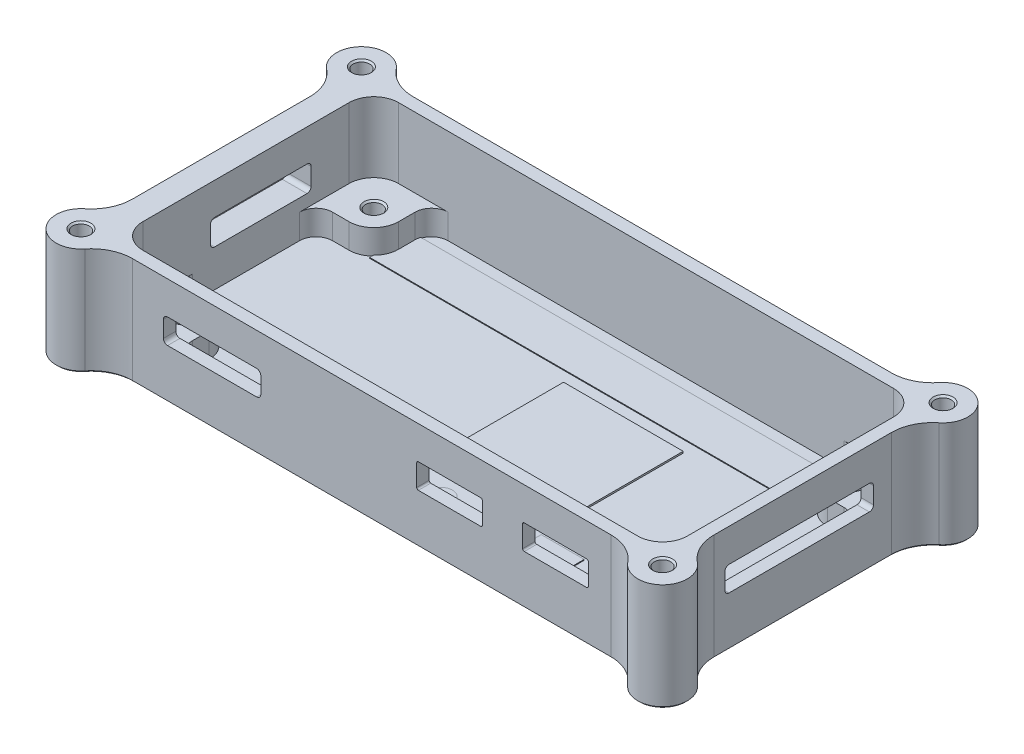
from build123d import *

# Parameters (mm, degrees)
EXTRUDE_2_DEPTH           = 1.5
EXTRUDE_3_DEPTH           = 11.5
EXTRUDE_6_DEPTH           = 3
FILLET_3_R                = 2
HOLE_WIZARD_2_0_2_1_D     = 2
HOLE_WIZARD_2_0_2_1_DEPTH = 4
HOLE_WIZARD_2_0_2_1_TIP   = 0.600860619
SKETCH_13_W               = 12.2
SKETCH_13_H               = 3.1
CUT_EXTRUDE_2_DEPTH       = 3
FILLET_4_R                = 0.5
CUT_EXTRUDE_3_DEPTH       = 2
CUT_EXTRUDE_4_DEPTH       = 3
CUT_EXTRUDE_5_DEPTH       = 2
CHAMFER_1_SIZE            = 0.2
SKETCH_17_W               = 80
SKETCH_17_H               = 40
CUT_EXTRUDE_6_DEPTH       = 15
SKETCH_20_R               = 3
SKETCH_20_R_2             = 1
EXTRUDE_11_DEPTH          = 13
FILLET_7_R                = 5
SKETCH_21_W               = 14.5
SKETCH_21_H               = 14.5
EXTRUDE_12_DEPTH          = 0.2
EXTRUDE_13_DEPTH          = 0.1
SKETCH_23_W               = 5.2
SKETCH_23_H               = 5.2
EXTRUDE_14_DEPTH          = 0.1
SKETCH_24_R               = 1.4
EXTRUDE_15_DEPTH          = 0.1
CHAMFER_2_SIZE            = 0.2
CHAMFER_3_SIZE            = 0.2
SKETCH_25_W               = 8
SKETCH_25_H               = 2.6
EXTRUDE_16_DEPTH          = 0.1


with BuildPart() as part:
    # 草图3 → 凸台-拉伸2 (new body)
    with BuildSketch(Plane(origin=(0, 0, 0), x_dir=(1, 0, 0), z_dir=(0, 1, 0))):
        with BuildLine():
            Line((33, -17.5), (-33, -17.5))
            ThreePointArc((-33, -17.5), (-35.121320344, -16.621320344), (-36, -14.5))
            Line((-36, -14.5), (-36, 14.5))
            ThreePointArc((-36, 14.5), (-35.121320344, 16.621320344), (-33, 17.5))
            Line((-33, 17.5), (33, 17.5))
            ThreePointArc((33, 17.5), (35.121320344, 16.621320344), (36, 14.5))
            Line((36, 14.5), (36, -14.5))
            ThreePointArc((36, -14.5), (35.121320344, -16.621320344), (33, -17.5))
        make_face()
    extrude(amount=EXTRUDE_2_DEPTH)

    # 草图5 → 凸台-拉伸3 (add)
    with BuildSketch(Plane(origin=(0, 1.5, 0), x_dir=(1, 0, 0), z_dir=(0, 1, 0))):
        with BuildLine():
            Line((33, -17.5), (-33, -17.5))
            ThreePointArc((-33, -17.5), (-35.121320344, -16.621320344), (-36, -14.5))
            Line((-36, -14.5), (-36, 14.5))
            ThreePointArc((-36, 14.5), (-35.121320344, 16.621320344), (-33, 17.5))
            Line((-33, 17.5), (33, 17.5))
            ThreePointArc((33, 17.5), (35.121320344, 16.621320344), (36, 14.5))
            Line((36, 14.5), (36, -14.5))
            ThreePointArc((36, -14.5), (35.121320344, -16.621320344), (33, -17.5))
        make_face()
        with BuildLine():
            Line((30, -15.5), (-30, -15.5))
            ThreePointArc((-30, -15.5), (-32.121320344, -14.621320344), (-33, -12.5))
            Line((-33, -12.5), (-33, 12.5))
            ThreePointArc((-33, 12.5), (-32.121320344, 14.621320344), (-30, 15.5))
            Line((-30, 15.5), (30, 15.5))
            ThreePointArc((30, 15.5), (32.121320344, 14.621320344), (33, 12.5))
            Line((33, 12.5), (33, -12.5))
            ThreePointArc((33, -12.5), (32.121320344, -14.621320344), (30, -15.5))
        make_face(mode=Mode.SUBTRACT)
    extrude(amount=EXTRUDE_3_DEPTH)

    # 草图6 → 凸台-拉伸6 (add)
    with BuildSketch(Plane(origin=(0, 1.5, 0), x_dir=(1, 0, 0), z_dir=(0, 1, 0))):
        with BuildLine():
            Line((-29, 8.5), (-33, 8.5))
            Line((-33, 8.5), (-33, 12.5))
            ThreePointArc((-33, 12.5), (-32.121320344, 14.621320344), (-30, 15.5))
            Line((-30, 15.5), (-26, 15.5))
            Line((-26, 15.5), (-26, 11.5))
            ThreePointArc((-26, 11.5), (-26.878679656, 9.378679656), (-29, 8.5))
        make_face()
        with BuildLine():
            Line((26, 11.5), (26, 15.5))
            Line((26, 15.5), (30, 15.5))
            ThreePointArc((30, 15.5), (32.121320344, 14.621320344), (33, 12.5))
            Line((33, 12.5), (33, 8.5))
            Line((33, 8.5), (29, 8.5))
            ThreePointArc((29, 8.5), (26.878679656, 9.378679656), (26, 11.5))
        make_face()
        with BuildLine():
            Line((-26, -15.5), (-30, -15.5))
            ThreePointArc((-30, -15.5), (-32.121320344, -14.621320344), (-33, -12.5))
            Line((-33, -12.5), (-33, -8.5))
            Line((-33, -8.5), (-29, -8.5))
            ThreePointArc((-29, -8.5), (-26.878679656, -9.378679656), (-26, -11.5))
            Line((-26, -11.5), (-26, -15.5))
        make_face()
        with BuildLine():
            Line((29, -8.5), (33, -8.5))
            Line((33, -8.5), (33, -12.5))
            ThreePointArc((33, -12.5), (32.121320344, -14.621320344), (30, -15.5))
            Line((30, -15.5), (26, -15.5))
            Line((26, -15.5), (26, -11.5))
            ThreePointArc((26, -11.5), (26.878679656, -9.378679656), (29, -8.5))
        make_face()
    extrude(amount=EXTRUDE_6_DEPTH)

    # 圆角3
    fillet_3_edges = [part.edges().sort_by_distance(p)[0] for p in [
        (-26, 3, 15.5),
        (-33, 3, 8.5),
        (26, 3, 15.5),
        (33, 3, 8.5),
        (-26, 3, -15.5),
        (-33, 3, -8.5),
        (33, 3, -8.5),
        (26, 3, -15.5),
    ]]
    fillet(fillet_3_edges, radius=FILLET_3_R)

    # 草图11 → 旋转8 (revolve)
    with BuildSketch(Plane(origin=(0, 0, 11.5), x_dir=(-1, 0, 0), z_dir=(0, 0, 1))):
        with BuildLine():
            Line((29, 0), (25.68337521, 0))
            ThreePointArc((25.68337521, 0), (27.267949192, 0.744562647), (29, 1))
            Line((29, 1), (29, 0))
        make_face()
    revolve_8 = revolve(axis=Axis((-29, 0, 11.5), (0, -1, 0)))

    # 镜向1: 旋转8 across plane
    add(revolve_8.mirror(Plane(origin=(0, 0, 0), x_dir=(0, 0, 1), z_dir=(1, 0, 0))))

    # 镜向2: 旋转8 across plane
    add(revolve_8.mirror(Plane(origin=(0, 0, 0), x_dir=(1, 0, 0), z_dir=(0, 0, -1))))

    # 镜向2 copy 1 sketch → 镜向2 copy 1 (revolve)
    with BuildSketch(Plane(origin=(0, 0, -11.5), x_dir=(1, 0, 0), z_dir=(0, 0, -1))):
        with BuildLine():
            Line((29, 0), (25.68337521, 0))
            ThreePointArc((25.68337521, 0), (27.267949192, 0.744562647), (29, 1))
            Line((29, 1), (29, 0))
        make_face()
    revolve(axis=Axis((29, 0, -11.5), (0, -1, 0)))

    # Ø2.0 (2) 直径孔1
    with Locations(Plane(origin=(29, 4.5, -11.5), x_dir=(0, 0, 1), z_dir=(0, 1, 0))):
        with Locations((0, 0), (23, 0), (0, -58), (23, -58)):
            Hole(HOLE_WIZARD_2_0_2_1_D / 2, depth=HOLE_WIZARD_2_0_2_1_DEPTH)
            with Locations((0, 0, -(HOLE_WIZARD_2_0_2_1_DEPTH + HOLE_WIZARD_2_0_2_1_TIP / 2))):  # 118° drill point
                Cone(0, HOLE_WIZARD_2_0_2_1_D / 2, HOLE_WIZARD_2_0_2_1_TIP, mode=Mode.SUBTRACT)

    # 草图13 → 切除-拉伸2 (cut)
    with BuildSketch(Plane.ZY.offset(36)):
        with Locations((-1.8, 7.55)):
            Rectangle(SKETCH_13_W, SKETCH_13_H)
    extrude(amount=-CUT_EXTRUDE_2_DEPTH, mode=Mode.SUBTRACT)

    # 圆角4
    fillet_4_edges = [part.edges().sort_by_distance(p)[0] for p in [
        (-34.5, 9.1, 4.3),
        (-34.5, 6, 4.3),
        (-34.5, 6, -7.9),
        (-34.5, 9.1, -7.9),
    ]]
    fillet(fillet_4_edges, radius=FILLET_4_R)

    # 草图14 → 切除-拉伸3 (cut)
    with BuildSketch(Plane.XY.offset(17.5)):
        with BuildLine():
            Line((-14.2, 6.5), (-14.2, 8.5))
            ThreePointArc((-14.2, 8.5), (-14.346446609, 8.853553391), (-14.7, 9))
            Line((-14.7, 9), (-25.5, 9))
            ThreePointArc((-25.5, 9), (-25.853553391, 8.853553391), (-26, 8.5))
            Line((-26, 8.5), (-26, 6.5))
            ThreePointArc((-26, 6.5), (-25.853553391, 6.146446609), (-25.5, 6))
            Line((-25.5, 6), (-14.7, 6))
            ThreePointArc((-14.7, 6), (-14.346446609, 6.146446609), (-14.2, 6.5))
        make_face()
    extrude(amount=-CUT_EXTRUDE_3_DEPTH, mode=Mode.SUBTRACT)

    # 草图15 → 切除-拉伸4 (cut)
    with BuildSketch(Plane(origin=(36, 0, 0), x_dir=(0, 0, -1), z_dir=(1, 0, 0))):
        with BuildLine():
            Line((8.064447531, 6), (-8.935552469, 6))
            ThreePointArc((-8.935552469, 6), (-9.289105859, 6.146446609), (-9.435552469, 6.5))
            Line((-9.435552469, 6.5), (-9.435552469, 8.5))
            ThreePointArc((-9.435552469, 8.5), (-9.289105859, 8.853553391), (-8.935552469, 9))
            Line((-8.935552469, 9), (8.064447531, 9))
            ThreePointArc((8.064447531, 9), (8.418000922, 8.853553391), (8.564447531, 8.5))
            Line((8.564447531, 8.5), (8.564447531, 6.5))
            ThreePointArc((8.564447531, 6.5), (8.418000922, 6.146446609), (8.064447531, 6))
        make_face()
    extrude(amount=-CUT_EXTRUDE_4_DEPTH, mode=Mode.SUBTRACT)

    # 草图16 → 切除-拉伸5 (cut)
    with BuildSketch(Plane.XY.offset(17.5)):
        with BuildLine():
            Line((12.46, 9), (4.9, 9))
            ThreePointArc((4.9, 9), (4.758578644, 8.941421356), (4.7, 8.8))
            Line((4.7, 8.8), (4.7, 6.2))
            ThreePointArc((4.7, 6.2), (4.758578644, 6.058578644), (4.9, 6))
            Line((4.9, 6), (12.46, 6))
            ThreePointArc((12.46, 6), (12.601421356, 6.058578644), (12.66, 6.2))
            Line((12.66, 6.2), (12.66, 8.8))
            ThreePointArc((12.66, 8.8), (12.601421356, 8.941421356), (12.46, 9))
        make_face()
        with BuildLine():
            Line((17.54, 8.8), (17.54, 6.2))
            ThreePointArc((17.54, 6.2), (17.598578644, 6.058578644), (17.74, 6))
            Line((17.74, 6), (25.3, 6))
            ThreePointArc((25.3, 6), (25.441421356, 6.058578644), (25.5, 6.2))
            Line((25.5, 6.2), (25.5, 8.8))
            ThreePointArc((25.5, 8.8), (25.441421356, 8.941421356), (25.3, 9))
            Line((25.3, 9), (17.74, 9))
            ThreePointArc((17.74, 9), (17.598578644, 8.941421356), (17.54, 8.8))
        make_face()
    extrude(amount=-CUT_EXTRUDE_5_DEPTH, mode=Mode.SUBTRACT)

    # 倒角1
    chamfer_1_edges = [part.edges().sort_by_distance(p)[0] for p in [
        (-29, 4.5, 12.5),
        (-29, 4.5, -10.5),
        (29, 4.5, 12.5),
        (29, 4.5, -10.5),
    ]]
    chamfer(chamfer_1_edges, length=CHAMFER_1_SIZE)

    # 草图17 → 切除-拉伸6 (cut)
    with BuildSketch(Plane.XZ):
        Rectangle(SKETCH_17_W, SKETCH_17_H)
        with BuildLine():
            Line((-36, 14), (-36, -14))
            ThreePointArc((-36, -14), (-35.121320344, -16.121320344), (-33, -17))
            Line((-33, -17), (31.5, -17))
            ThreePointArc((31.5, -17), (33.621320344, -16.121320344), (34.5, -14))
            Line((34.5, -14), (34.5, 14))
            ThreePointArc((34.5, 14), (33.621320344, 16.121320344), (31.5, 17))
            Line((31.5, 17), (-33, 17))
            ThreePointArc((-33, 17), (-35.121320344, 16.121320344), (-36, 14))
        make_face(mode=Mode.SUBTRACT)
    extrude(amount=-CUT_EXTRUDE_6_DEPTH, mode=Mode.SUBTRACT)

    # 草图20 → 凸台-拉伸11 (add)
    # profile 1 of 4: a face of its own
    with BuildSketch(Plane(origin=(0, 13, 0), x_dir=(1, 0, 0), z_dir=(0, 1, 0))):
        with Locations((-36, 17)):
            Circle(SKETCH_20_R)
        with Locations(Location((-36, 17, 0), (0, 0, 270))):
            Circle(SKETCH_20_R_2, mode=Mode.SUBTRACT)
    # profile 2 of 4: a face of its own
    with BuildSketch(Plane(origin=(0, 13, 0), x_dir=(1, 0, 0), z_dir=(0, 1, 0))):
        with Locations((-36, -17)):
            Circle(SKETCH_20_R)
        with Locations(Location((-36, -17, 0), (0, 0, 270))):
            Circle(SKETCH_20_R_2, mode=Mode.SUBTRACT)
    # profile 3 of 4: a face of its own
    with BuildSketch(Plane(origin=(0, 13, 0), x_dir=(1, 0, 0), z_dir=(0, 1, 0))):
        with Locations((34.5, -17)):
            Circle(SKETCH_20_R)
        with Locations(Location((34.5, -17, 0), (0, 0, 270))):
            Circle(SKETCH_20_R_2, mode=Mode.SUBTRACT)
    # profile 4 of 4: a face of its own
    with BuildSketch(Plane(origin=(0, 13, 0), x_dir=(1, 0, 0), z_dir=(0, 1, 0))):
        with Locations((34.5, 17)):
            Circle(SKETCH_20_R)
        with Locations(Location((34.5, 17, 0), (0, 0, 270))):
            Circle(SKETCH_20_R_2, mode=Mode.SUBTRACT)
    extrude(amount=-EXTRUDE_11_DEPTH)

    # 圆角7
    fillet_7_edges = [part.edges().sort_by_distance(p)[0] for p in [
        (-36, 6.5, 14),
        (34.5, 6.5, -14),
        (31.5, 6.5, 17),
        (31.5, 6.5, -17),
        (-33, 6.5, -17),
        (-36, 6.5, -14),
        (-33, 6.5, 17),
        (34.5, 6.5, 14),
    ]]
    fillet(fillet_7_edges, radius=FILLET_7_R)

    # 草图21 → 凸台-拉伸12 (add)
    with BuildSketch(Plane(origin=(0, 1.5, 0), x_dir=(1, 0, 0), z_dir=(0, 1, 0))):
        with Locations((5.3, 0.2)):
            Rectangle(SKETCH_21_W, SKETCH_21_H)
    extrude(amount=EXTRUDE_12_DEPTH)

    # 草图22 → 凸台-拉伸13 (add)
    with BuildSketch(Plane(origin=(0, 1.5, 0), x_dir=(1, 0, 0), z_dir=(0, 1, 0))):
        Polygon((-26.9, 14.1), (26.9, 14.1), (26.9, 8.9), (-26.9, 8.9), (-26.9, 11.5), align=None)
    extrude(amount=EXTRUDE_13_DEPTH)

    # 草图23 → 凸台-拉伸14 (add)
    with BuildSketch(Plane(origin=(0, 1.5, 0), x_dir=(1, 0, 0), z_dir=(0, 1, 0))):
        with Locations((15.2, -12.4)):
            Rectangle(SKETCH_23_W, SKETCH_23_H)
    extrude(amount=EXTRUDE_14_DEPTH)

    # 草图24 → 凸台-拉伸15 (add)
    with BuildSketch(Plane(origin=(0, 1.5, 0), x_dir=(1, 0, 0), z_dir=(0, 1, 0))):
        with Locations(Location((2.54, -11.913, 0), (0, 0, 270))):
            Circle(SKETCH_24_R)
        with Locations(Location((-1.016, -11.913, 0), (0, 0, 270))):
            Circle(SKETCH_24_R)
    extrude(amount=EXTRUDE_15_DEPTH)

    # 倒角2
    chamfer_2_edges = [part.edges().sort_by_distance(p)[0] for p in [
        (-38.121320344, 0, 19.121320344),
        (-36, 0, 0),
        (-0.75, 0, 17),
        (36.621320344, 0, 19.121320344),
        (34.5, 0, 0),
        (-38.121320344, 0, -19.121320344),
        (-0.75, 0, -17),
        (36.621320344, 0, -19.121320344),
        (-36.493060906, 0, 12.920065511),
        (-31.920065511, 0, 17.493060906),
        (30.420065511, 0, 17.493060906),
        (34.993060906, 0, 12.920065511),
        (-31.920065511, 0, -17.493060906),
        (-36.493060906, 0, -12.920065511),
        (30.420065511, 0, -17.493060906),
        (34.993060906, 0, -12.920065511),
    ]]
    chamfer(chamfer_2_edges, length=CHAMFER_2_SIZE)

    # 倒角3
    chamfer_3_edges = [part.edges().sort_by_distance(p)[0] for p in [
        (-36, 0, -18),
        (-36, 13, -18),
        (-36, 0, 16),
        (-36, 13, 16),
        (34.5, 0, 16),
        (34.5, 13, 16),
        (34.5, 0, -18),
        (34.5, 13, -18),
    ]]
    chamfer(chamfer_3_edges, length=CHAMFER_3_SIZE)

    # 草图25 → 凸台-拉伸16 (add)
    with BuildSketch(Plane(origin=(0, 1.5, 0), x_dir=(1, 0, 0), z_dir=(0, 1, 0))):
        with Locations((-28.5, -6.3)):
            Rectangle(SKETCH_25_W, SKETCH_25_H)
    extrude(amount=EXTRUDE_16_DEPTH)


solid = part.part
